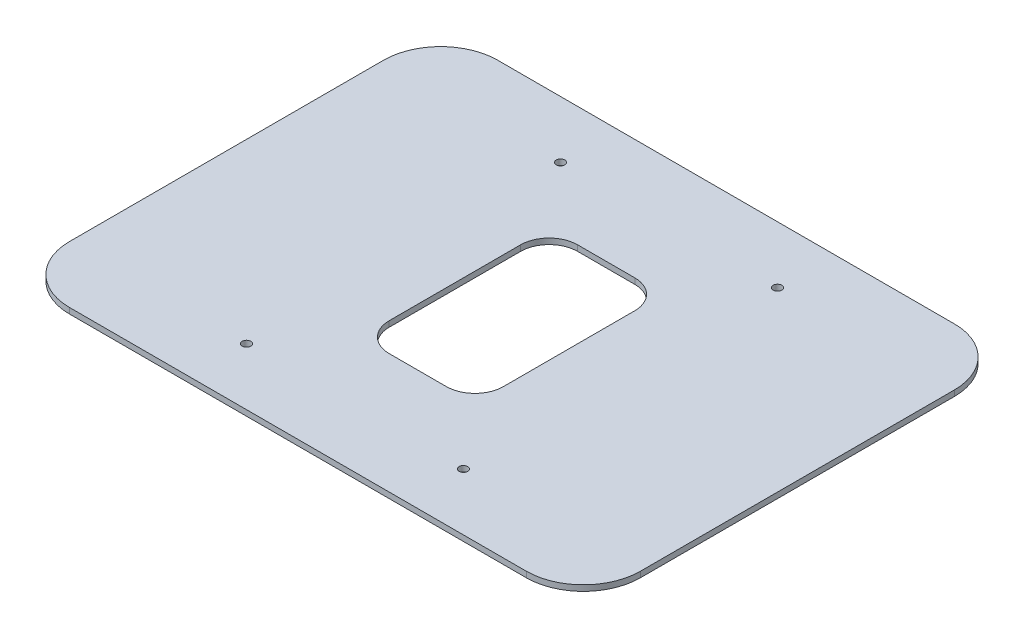
from build123d import *

# Parameters (mm, degrees)
RESSALTO_EXTRUS_O1_DEPTH = 2
ESBO_O2_R                = 1.5
CORTE_EXTRUS_O1_DEPTH    = 10
CORTE_EXTRUS_O2_DEPTH    = 10


with BuildPart() as part:
    # Esboço1 → Ressalto-extrusão1 (new body)
    with BuildSketch(Plane(origin=(0, 0, 0), x_dir=(1, 0, 0), z_dir=(0, 1, 0))):
        with BuildLine():
            Line((-40.816022398, 183.1144834), (119.183977602, 183.1144834))
            ThreePointArc((119.183977602, 183.1144834), (133.326113225, 177.256619024), (139.183977602, 163.1144834))
            Line((139.183977602, 163.1144834), (139.183977602, 53.1144834))
            ThreePointArc((139.183977602, 53.1144834), (133.326113225, 38.972347776), (119.183977602, 33.1144834))
            Line((119.183977602, 33.1144834), (-40.816022398, 33.1144834))
            ThreePointArc((-40.816022398, 33.1144834), (-54.958158022, 38.972347776), (-60.816022398, 53.1144834))
            Line((-60.816022398, 53.1144834), (-60.816022398, 163.1144834))
            ThreePointArc((-60.816022398, 163.1144834), (-54.958158022, 177.256619024), (-40.816022398, 183.1144834))
        make_face()
    extrude(amount=RESSALTO_EXTRUS_O1_DEPTH)

    # Esboço2 → Corte-extrusão1 (cut)
    with BuildSketch(Plane(origin=(0, 2, 0), x_dir=(1, 0, 0), z_dir=(0, 1, 0))):
        with Locations(Location((1.183977602, 163.1144834, 0), (0, 0, 270))):
            Circle(ESBO_O2_R)
        with Locations(Location((77.183977602, 163.1144834, 0), (0, 0, 270))):
            Circle(ESBO_O2_R)
        with Locations(Location((77.183977602, 53.1144834, 0), (0, 0, 270))):
            Circle(ESBO_O2_R)
        with Locations(Location((1.183977602, 53.1144834, 0), (0, 0, 270))):
            Circle(ESBO_O2_R)
    extrude(amount=-CORTE_EXTRUS_O1_DEPTH, mode=Mode.SUBTRACT)

    # Esboço3 → Corte-extrusão2 (cut)
    with BuildSketch(Plane(origin=(0, 2, 0), x_dir=(1, 0, 0), z_dir=(0, 1, 0))):
        with BuildLine():
            Line((29.183977602, 141.1144834), (49.183977602, 141.1144834))
            ThreePointArc((49.183977602, 141.1144834), (56.255045413, 138.185551212), (59.183977602, 131.1144834))
            Line((59.183977602, 131.1144834), (59.183977602, 85.1144834))
            ThreePointArc((59.183977602, 85.1144834), (56.255045413, 78.043415588), (49.183977602, 75.1144834))
            Line((49.183977602, 75.1144834), (29.183977602, 75.1144834))
            ThreePointArc((29.183977602, 75.1144834), (22.11290979, 78.043415588), (19.183977602, 85.1144834))
            Line((19.183977602, 85.1144834), (19.183977602, 131.1144834))
            ThreePointArc((19.183977602, 131.1144834), (22.11290979, 138.185551212), (29.183977602, 141.1144834))
        make_face()
    extrude(amount=-CORTE_EXTRUS_O2_DEPTH, mode=Mode.SUBTRACT)


solid = part.part
